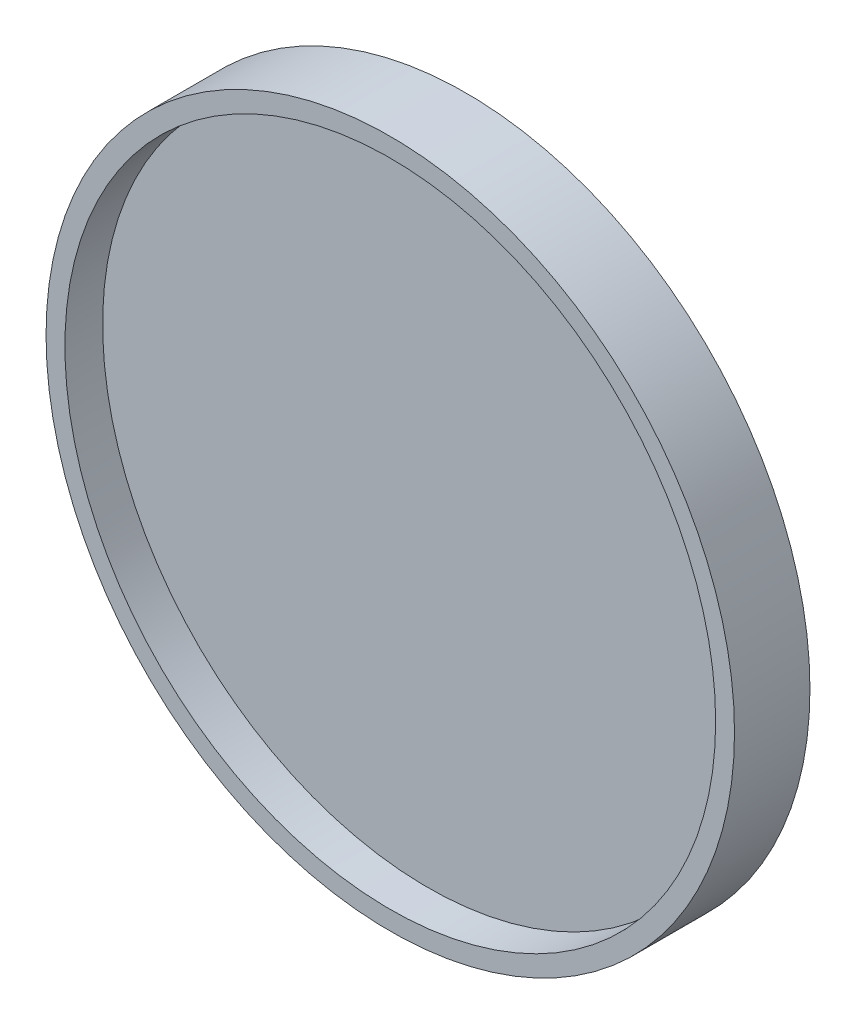
from build123d import *

# Parameters (mm, degrees)
SKETCH1_R           = 46.355
SKETCH1_R_2         = 43.815
BOSS_EXTRUDE1_DEPTH = 5.08
BOSS_EXTRUDE2_START = 5.08
SKETCH2_R           = 46.355
BOSS_EXTRUDE2_DEPTH = 5.08


with BuildPart() as part:
    # Sketch1 → Boss-Extrude1 (new body)
    with BuildSketch(Plane.XY):
        Circle(SKETCH1_R)
        Circle(SKETCH1_R_2, mode=Mode.SUBTRACT)
    extrude(amount=BOSS_EXTRUDE1_DEPTH)

    # Sketch2 → Boss-Extrude2 (add)
    with BuildSketch(Plane(origin=(0, 0, 0), x_dir=(-1, 0, 0), z_dir=(0, 0, -1)).offset(BOSS_EXTRUDE2_START)):
        Circle(SKETCH2_R)
    extrude(amount=-BOSS_EXTRUDE2_DEPTH)


solid = part.part
